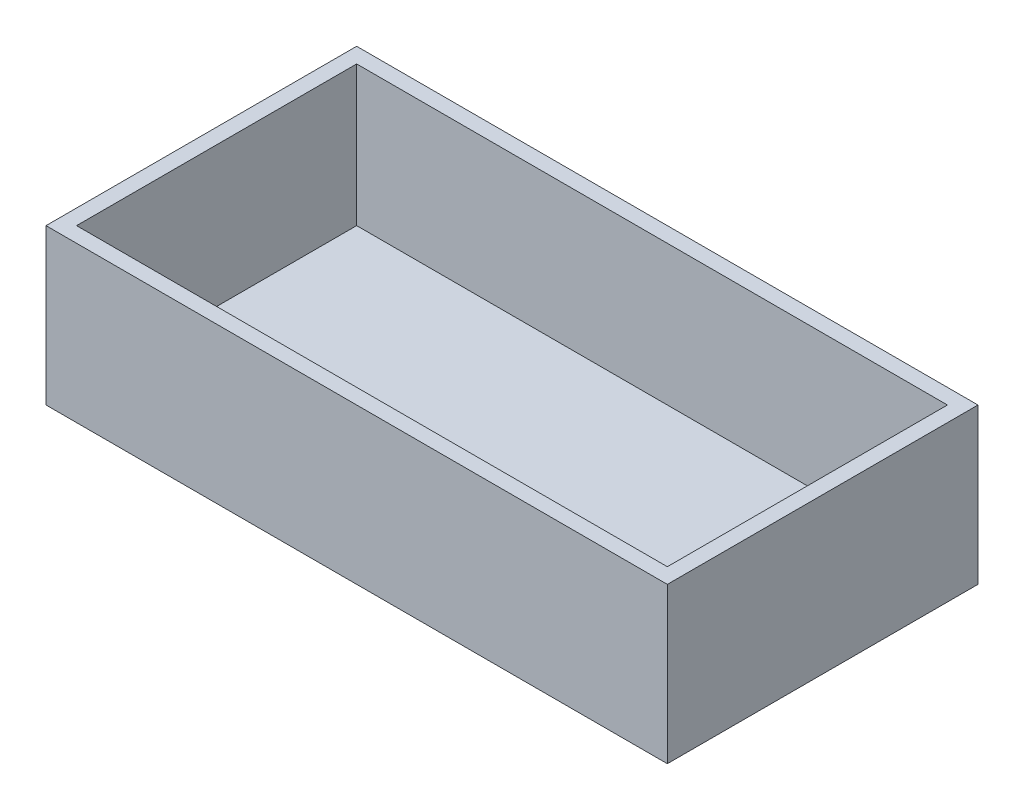
from build123d import *

# Parameters (mm, degrees)
SKETCH1_W           = 203.2
SKETCH1_H           = 101.6
BOSS_EXTRUDE1_DEPTH = 50.8
SHELL3_T            = -5


with BuildPart() as part:
    # Sketch1 → Boss-Extrude1 (new body)
    with BuildSketch(Plane(origin=(0, 0, 0), x_dir=(1, 0, 0), z_dir=(0, 1, 0))):
        Rectangle(SKETCH1_W, SKETCH1_H)
    extrude(amount=BOSS_EXTRUDE1_DEPTH)

    # Shell3
    shell3_openings = [part.faces().sort_by_distance(p)[0] for p in [
        (0, 50.8, 0),
    ]]
    offset(amount=SHELL3_T, openings=shell3_openings, kind=Kind.INTERSECTION)


solid = part.part
